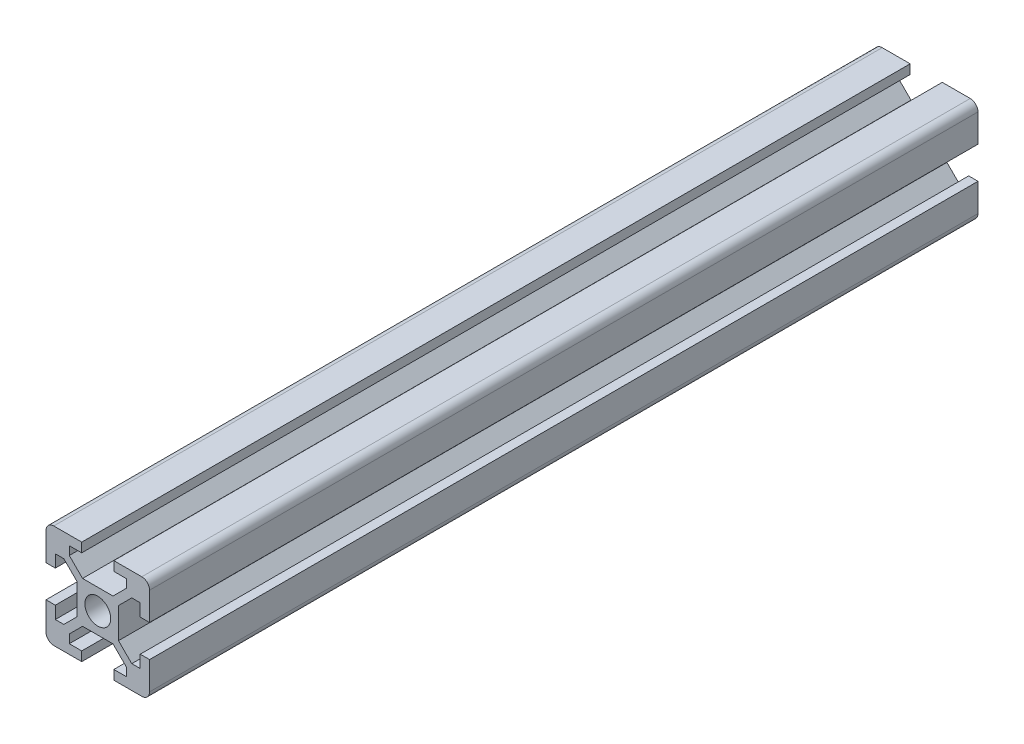
from build123d import *

# Parameters (mm, degrees)
SKETCH_1_R      = 2.5
EXTRUDE_2_DEPTH = 160


with BuildPart() as part:
    # 草图1 → 凸台-拉伸2 (new body)
    with BuildSketch(Plane.XY):
        with BuildLine():
            Line((5.5, -8.2), (5.5, -6.560660172))
            Line((5.5, -6.560660172), (2.939339828, -4))
            Line((2.939339828, -4), (-2.939339828, -4))
            Line((-2.939339828, -4), (-5.5, -6.560660172))
            Line((-5.5, -6.560660172), (-5.5, -8.2))
            Line((-5.5, -8.2), (-3.1, -8.2))
            Line((-3.1, -8.2), (-3.1, -10))
            Line((-3.1, -10), (-8.5, -10))
            ThreePointArc((-8.5, -10), (-9.560660172, -9.560660172), (-10, -8.5))
            Line((-10, -8.5), (-10, -3.1))
            Line((-10, -3.1), (-8.2, -3.1))
            Line((-8.2, -3.1), (-8.2, -5.5))
            Line((-8.2, -5.5), (-6.560660172, -5.5))
            Line((-6.560660172, -5.5), (-4, -2.939339828))
            Line((-4, -2.939339828), (-4, 2.939339828))
            Line((-4, 2.939339828), (-6.560660172, 5.5))
            Line((-6.560660172, 5.5), (-8.2, 5.5))
            Line((-8.2, 5.5), (-8.2, 3.1))
            Line((-8.2, 3.1), (-10, 3.1))
            Line((-10, 3.1), (-10, 8.5))
            ThreePointArc((-10, 8.5), (-9.560660172, 9.560660172), (-8.5, 10))
            Line((-8.5, 10), (-3.1, 10))
            Line((-3.1, 10), (-3.1, 8.2))
            Line((-3.1, 8.2), (-5.5, 8.2))
            Line((-5.5, 8.2), (-5.5, 6.560660172))
            Line((-5.5, 6.560660172), (-2.939339828, 4))
            Line((-2.939339828, 4), (2.939339828, 4))
            Line((2.939339828, 4), (5.5, 6.560660172))
            Line((5.5, 6.560660172), (5.5, 8.2))
            Line((5.5, 8.2), (3.1, 8.2))
            Line((3.1, 8.2), (3.1, 10))
            Line((3.1, 10), (8.5, 10))
            ThreePointArc((8.5, 10), (9.560660172, 9.560660172), (10, 8.5))
            Line((10, 8.5), (10, 3.1))
            Line((10, 3.1), (8.2, 3.1))
            Line((8.2, 3.1), (8.2, 5.5))
            Line((8.2, 5.5), (6.560660172, 5.5))
            Line((6.560660172, 5.5), (4, 2.939339828))
            Line((4, 2.939339828), (4, -2.939339828))
            Line((4, -2.939339828), (6.560660172, -5.5))
            Line((6.560660172, -5.5), (8.2, -5.5))
            Line((8.2, -5.5), (8.2, -3.1))
            Line((8.2, -3.1), (10, -3.1))
            Line((10, -3.1), (10, -8.5))
            ThreePointArc((10, -8.5), (9.560660172, -9.560660172), (8.5, -10))
            Line((8.5, -10), (3.1, -10))
            Line((3.1, -10), (3.1, -8.2))
            Line((3.1, -8.2), (5.5, -8.2))
        make_face()
        Circle(SKETCH_1_R, mode=Mode.SUBTRACT)
    extrude(amount=-EXTRUDE_2_DEPTH)


solid = part.part
